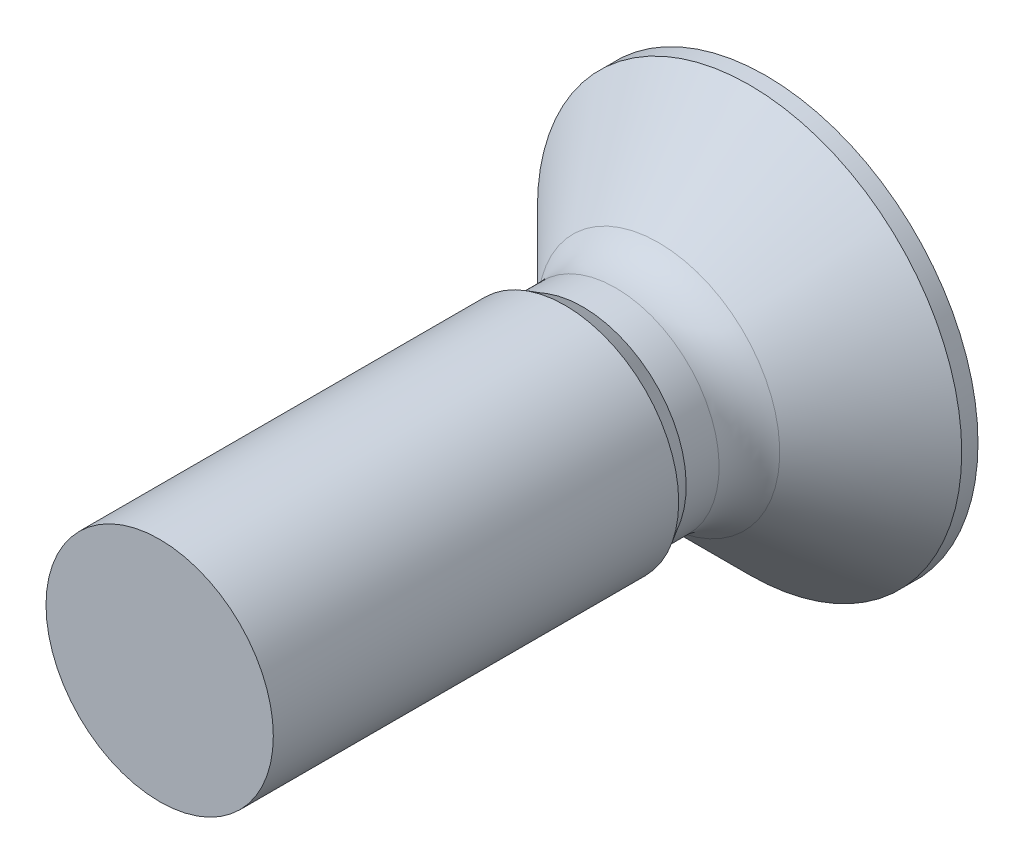
from build123d import *

# Parameters (mm, degrees)
SKETCH2_OUTSIDE_W       = 10.368
SKETCH2_OUTSIDE_H       = 10.368
SKETCH2_OUTSIDE_R       = 2.8
CUT_EXTRUDE1_DEPTH      = 10.06513549
FILLET1_R               = 0.8
ENL_V_MAT_EXTRU_1_DEPTH = 1


with BuildPart() as part:
    # Sketch1 → Base-Revolve (revolve)
    with BuildSketch(Plane(origin=(0, 0, 0), x_dir=(0, 0, -1), z_dir=(1, 0, 0))):
        Polygon((1.65, 0), (1.65, 3.0146875), (0, 1.3646875), (-0.765631875, 1.3646875), (-1, 1.5), (-6.35, 1.5), (-6.35, 0), align=None)
    revolve(axis=Axis((0, 0, -1.65), (0, 0, 1)))

    # Sketch2 outside → Cut-Extrude1 (cut, through all)
    with BuildSketch(Plane(origin=(0, 0, -1.65), x_dir=(-1, 0, 0), z_dir=(0, 0, -1))):
        Rectangle(SKETCH2_OUTSIDE_W, SKETCH2_OUTSIDE_H)
        with Locations(Location((0, 0, 0), (0, 0, 90))):
            Circle(SKETCH2_OUTSIDE_R, mode=Mode.SUBTRACT)
    extrude(amount=-CUT_EXTRUDE1_DEPTH, mode=Mode.SUBTRACT)

    # Fillet1
    fillet1_edges = [part.edges().sort_by_distance(p)[0] for p in [
        (0, -1.3646875, 0),
    ]]
    fillet(fillet1_edges, radius=FILLET1_R)

    # Esquisse1 → Enlèv. mat.-Extru.1 (cut)
    with BuildSketch(Plane(origin=(0, 0, -1.65), x_dir=(-1, 0, 0), z_dir=(0, 0, -1))):
        with BuildLine():
            ThreePointArc((1.088832331, -0.880025088), (1.212435565, -0.7), (1.306540248, -0.502943915))
            ThreePointArc((1.306540248, -0.502943915), (1.025, 0), (1.306540248, 0.502943915))
            ThreePointArc((1.306540248, 0.502943915), (1.212435565, 0.7), (1.088832331, 0.880025088))
            ThreePointArc((1.088832331, 0.880025088), (0.5125, 0.887676039), (0.217707917, 1.382969003))
            ThreePointArc((0.217707917, 1.382969003), (0, 1.4), (-0.217707917, 1.382969003))
            ThreePointArc((-0.217707917, 1.382969003), (-0.5125, 0.887676039), (-1.088832331, 0.880025088))
            ThreePointArc((-1.088832331, 0.880025088), (-1.212435565, 0.7), (-1.306540248, 0.502943915))
            ThreePointArc((-1.306540248, 0.502943915), (-1.025, 0), (-1.306540248, -0.502943915))
            ThreePointArc((-1.306540248, -0.502943915), (-1.212435565, -0.7), (-1.088832331, -0.880025088))
            ThreePointArc((-1.088832331, -0.880025088), (-0.5125, -0.887676039), (-0.217707917, -1.382969003))
            ThreePointArc((-0.217707917, -1.382969003), (0, -1.4), (0.217707917, -1.382969003))
            ThreePointArc((0.217707917, -1.382969003), (0.5125, -0.887676039), (1.088832331, -0.880025088))
        make_face()
    extrude(amount=-ENL_V_MAT_EXTRU_1_DEPTH, mode=Mode.SUBTRACT)


solid = part.part
